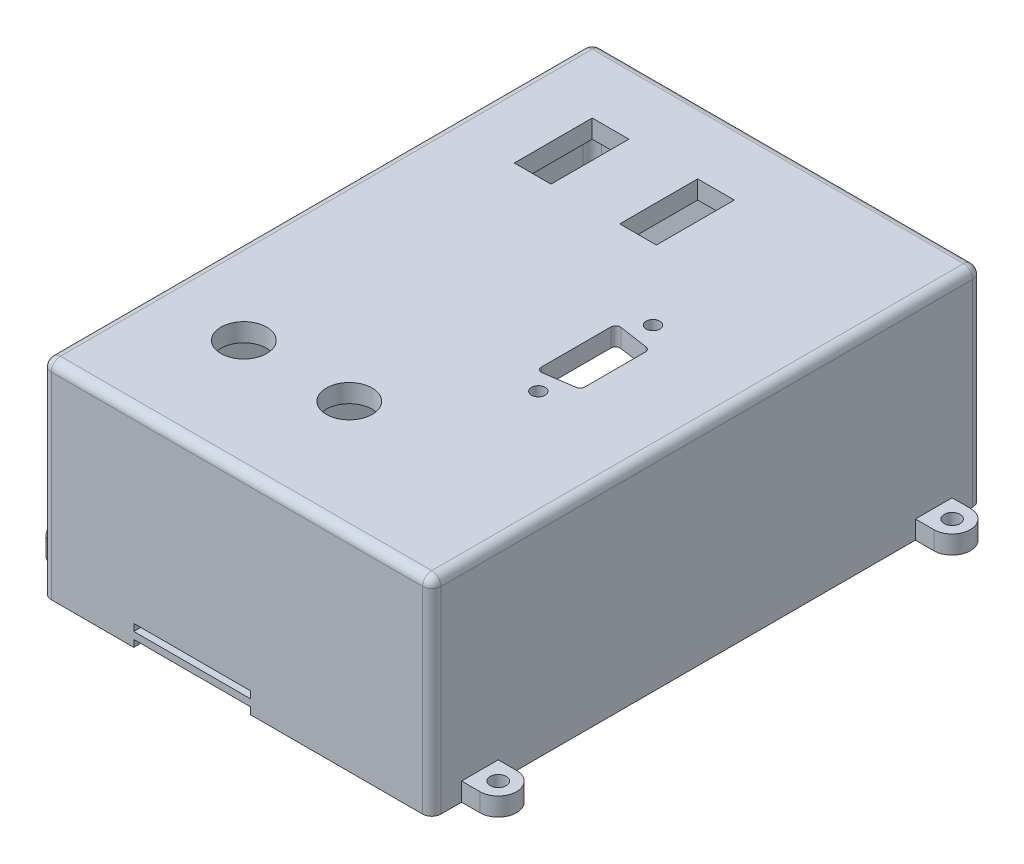
from build123d import *

# Parameters (mm, degrees)
SKETCH1_W               = 85
SKETCH1_H               = 120
BOSS_EXTRUDE1_DEPTH     = 20
SHELL2_T                = -4
SKETCH4_R               = 5
SKETCH4_W               = 8
SKETCH4_H               = 17
CUT_EXTRUDE1_DEPTH      = 20
SKETCH5_W               = 25.5
SKETCH5_H               = 1.5
CUT_EXTRUDE2_DEPTH      = 20
SKETCH6_R               = 1.75
BOSS_EXTRUDE2_DEPTH     = 4
CUT_EXTRUDE3_DEPTH      = 159.347718645
CUT_EXTRUDE3_DEPTH_BACK = 10
SKETCH7_W               = 25.5
SKETCH7_H               = 1.512902769
CUT_EXTRUDE4_START      = 45
SKETCH8_R               = 1.5
CUT_EXTRUDE4_DEPTH      = 10
FILLET1_R               = 1
FILLET2_R               = 2
FILLET3_R               = 2


with BuildPart() as part:
    # Sketch1 → Boss-Extrude1 (new body)
    with BuildSketch(Plane(origin=(0, 0, 0), x_dir=(1, 0, 0), z_dir=(0, 1, 0))):
        with Locations((42.5, 60)):
            Rectangle(SKETCH1_W, SKETCH1_H)
    extrude(amount=BOSS_EXTRUDE1_DEPTH)

    # Sketch2 → section 0 of loft1
    with BuildSketch(Plane(origin=(0, 45, 0), x_dir=(1, 0, 0), z_dir=(0, 1, 0)), mode=Mode.PRIVATE) as loft1_s0:
        with BuildLine():
            Line((0, 120), (85, 120))
            Line((85, 120), (85, 0))
            Line((85, 0), (0, 0))
            Line((0, 0), (0, 120))
        make_face()
    # loft up to a face of the part (loft1)
    loft([loft1_s0.sketch, part.faces().sort_by_distance((42.5, 20, -60))[0]])

    # Shell2
    shell2_openings = [part.faces().sort_by_distance(p)[0] for p in [
        (42.5, 0, -60),
    ]]
    offset(amount=SHELL2_T, openings=shell2_openings, kind=Kind.INTERSECTION)

    # Sketch4 → Cut-Extrude1 (cut)
    with BuildSketch(Plane(origin=(0, 45, 0), x_dir=(1, 0, 0), z_dir=(0, 1, 0))):
        with Locations(Location((19, 25, 0), (0, 0, 270))):
            Circle(SKETCH4_R)
        with Locations(Location((42, 25, 0), (0, 0, 270))):
            Circle(SKETCH4_R)
        with Locations((19, 96.5)):
            Rectangle(SKETCH4_W, SKETCH4_H)
        with Locations((42, 96.5)):
            Rectangle(SKETCH4_W, SKETCH4_H)
    extrude(amount=-CUT_EXTRUDE1_DEPTH, mode=Mode.SUBTRACT)

    # Sketch5 → Cut-Extrude2 (cut)
    with BuildSketch(Plane.XY):
        with Locations((32.75, 0.75)):
            Rectangle(SKETCH5_W, SKETCH5_H)
    extrude(amount=-CUT_EXTRUDE2_DEPTH, mode=Mode.SUBTRACT)

    # Sketch6 → Boss-Extrude2 (add)
    # profile 1 of 4: a face of its own
    with BuildSketch(Plane(origin=(0, 0, 0), x_dir=(-1, 0, 0), z_dir=(0, -1, 0))):
        with BuildLine():
            Line((-85, 6.5), (-89, 6.5))
            ThreePointArc((-89, 6.5), (-93, 10.5), (-89, 14.5))
            Line((-89, 14.5), (-85, 14.5))
            Line((-85, 14.5), (-85, 6.5))
        make_face()
        with Locations(Location((-89, 10.5, 0), (0, 0, 90))):
            Circle(SKETCH6_R, mode=Mode.SUBTRACT)
    # profile 2 of 4: a face of its own
    with BuildSketch(Plane(origin=(0, 0, 0), x_dir=(-1, 0, 0), z_dir=(0, -1, 0))):
        with BuildLine():
            Line((-85, 113.5), (-89, 113.5))
            ThreePointArc((-89, 113.5), (-93, 109.5), (-89, 105.5))
            Line((-89, 105.5), (-85, 105.5))
            Line((-85, 105.5), (-85, 113.5))
        make_face()
        with Locations(Location((-89, 109.5, 0), (0, 0, 90))):
            Circle(SKETCH6_R, mode=Mode.SUBTRACT)
    # profile 3 of 4: a face of its own
    with BuildSketch(Plane(origin=(0, 0, 0), x_dir=(-1, 0, 0), z_dir=(0, -1, 0))):
        with BuildLine():
            Line((0, 113.5), (4, 113.5))
            ThreePointArc((4, 113.5), (8, 109.5), (4, 105.5))
            Line((4, 105.5), (0, 105.5))
            Line((0, 105.5), (0, 113.5))
        make_face()
        with Locations(Location((4, 109.5, 0), (0, 0, 90))):
            Circle(SKETCH6_R, mode=Mode.SUBTRACT)
    # profile 4 of 4: a face of its own
    with BuildSketch(Plane(origin=(0, 0, 0), x_dir=(-1, 0, 0), z_dir=(0, -1, 0))):
        with BuildLine():
            Line((0, 14.5), (4, 14.5))
            ThreePointArc((4, 14.5), (8, 10.5), (4, 6.5))
            Line((4, 6.5), (0, 6.5))
            Line((0, 6.5), (0, 14.5))
        make_face()
        with Locations(Location((4, 10.5, 0), (0, 0, 90))):
            Circle(SKETCH6_R, mode=Mode.SUBTRACT)
    extrude(amount=-BOSS_EXTRUDE2_DEPTH)

    # Sketch7 → Cut-Extrude3 (cut, two sides: drawn at the far end of the back side and taken through both)
    with BuildSketch(Plane.XY.offset(-CUT_EXTRUDE3_DEPTH_BACK)):
        with Locations((32.75, 3.769108467)):
            Rectangle(SKETCH7_W, SKETCH7_H)
    extrude(amount=CUT_EXTRUDE3_DEPTH + CUT_EXTRUDE3_DEPTH_BACK, mode=Mode.SUBTRACT)

    # Sketch8 → Cut-Extrude4 (cut)
    with BuildSketch(Plane(origin=(0, 0, 0), x_dir=(1, 0, 0), z_dir=(0, 1, 0)).offset(CUT_EXTRUDE4_START)):
        with Locations(Location((60.75, 72.5, 0), (0, 0, 270))):
            Circle(SKETCH8_R)
        with Locations(Location((60.75, 47.5, 0), (0, 0, 270))):
            Circle(SKETCH8_R)
        Polygon((56.5, 68.75), (56.5, 51.25), (65, 52.5), (65, 67.5), align=None)
    extrude(amount=-CUT_EXTRUDE4_DEPTH, mode=Mode.SUBTRACT)

    # Fillet1
    fillet1_edges = [part.edges().sort_by_distance(p)[0] for p in [
        (56.5, 43, -51.25),
        (56.5, 43, -68.75),
        (65, 43, -67.5),
        (65, 43, -52.5),
    ]]
    fillet(fillet1_edges, radius=FILLET1_R)

    # Fillet2
    fillet2_edges = [part.edges().sort_by_distance(p)[0] for p in [
        (4, 20.5, -116),
        (4, 20.5, -4),
        (81, 20.5, -4),
        (81, 20.5, -116),
        (4, 41, -60),
        (42.5, 41, -4),
        (81, 41, -60),
        (42.5, 41, -116),
    ]]
    fillet(fillet2_edges, radius=FILLET2_R)

    # Fillet3
    fillet3_edges = [part.edges().sort_by_distance(p)[0] for p in [
        (0, 45, -60),
        (42.5, 45, 0),
        (85, 45, -60),
        (42.5, 45, -120),
        (0, 22.5, -120),
        (85, 22.5, -120),
        (85, 22.5, 0),
        (0, 22.5, 0),
    ]]
    fillet(fillet3_edges, radius=FILLET3_R)


solid = part.part
